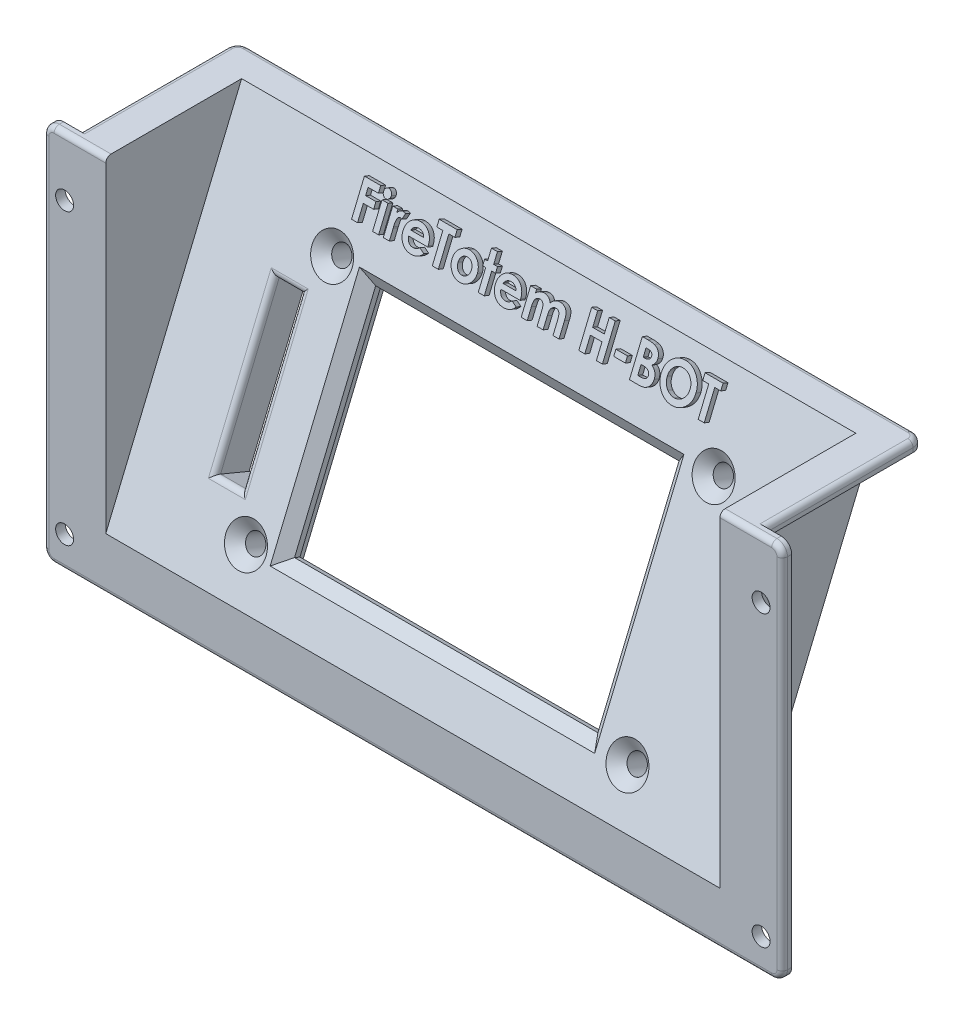
from build123d import *

# Parameters (mm, degrees)
SKETCH_1_R          = 1.7
EXTRUDE_1_DEPTH     = 1.8
EXTRUDE_2_DEPTH     = 1.8
EXTRUDE_3_DEPTH     = 116.4
EXTRUDE_4_DEPTH     = 1.8
EXTRUDE_5_DEPTH     = 1.8
SKETCH_6_W          = 91.3
SKETCH_6_H          = 51.75
EXTRUDE_6_DEPTH     = 5.2
SKETCH_7_W          = 5
SKETCH_7_H          = 29
CUT_EXTRUDE_1_DEPTH = 6.861538462
SKETCH_8_W          = 63
SKETCH_8_H          = 45
CUT_EXTRUDE_2_DEPTH = 3.75
SKETCH_9_W          = 57.5
SKETCH_9_H          = 40
CUT_EXTRUDE_3_DEPTH = 3.111538462
SKETCH_10_R         = 1.8
CUT_EXTRUDE_4_DEPTH = 6.861538462
FILLET_1_R          = 1
CHAMFER_1_SIZE      = 2
FILLET_2_R          = 1
SKETCH_12_W         = 1.13974359
SKETCH_12_H         = 4.640384615
SKETCH_12_W_2       = 2.198076923
SKETCH_12_H_2       = 1.058333333
EXTRUDE_7_DEPTH     = 1


with BuildPart() as part:
    # Эскиз1 → Бобышка-Вытянуть1 (new body)
    with BuildSketch(Plane.XY):
        with BuildLine():
            Line((-58.2, 35.9), (-58.2, -25.9))
            Line((-58.2, -25.9), (58.2, -25.9))
            Line((58.2, -25.9), (58.2, 35.9))
            Line((58.2, 35.9), (68, 35.9))
            ThreePointArc((68, 35.9), (69.414213562, 35.314213562), (70, 33.9))
            Line((70, 33.9), (70, -33.9))
            ThreePointArc((70, -33.9), (69.414213562, -35.314213562), (68, -35.9))
            Line((68, -35.9), (-68, -35.9))
            ThreePointArc((-68, -35.9), (-69.414213562, -35.314213562), (-70, -33.9))
            Line((-70, -33.9), (-70, 33.9))
            ThreePointArc((-70, 33.9), (-69.414213562, 35.314213562), (-68, 35.9))
            Line((-68, 35.9), (-58.2, 35.9))
        make_face()
        with Locations((-66, -29.9)):
            Circle(SKETCH_1_R, mode=Mode.SUBTRACT)
        with Locations((66, -29.9)):
            Circle(SKETCH_1_R, mode=Mode.SUBTRACT)
        with Locations((-66, 24.9)):
            Circle(SKETCH_1_R, mode=Mode.SUBTRACT)
        with Locations((66, 24.9)):
            Circle(SKETCH_1_R, mode=Mode.SUBTRACT)
    extrude(amount=EXTRUDE_1_DEPTH)

    # Эскиз2 → Бобышка-Вытянуть2 (add)
    with BuildSketch(Plane(origin=(0, 35.9, 0), x_dir=(1, 0, 0), z_dir=(0, 1, 0))):
        with BuildLine():
            Line((-58.2, 0), (-58.2, 24))
            Line((-58.2, 24), (58.2, 24))
            Line((58.2, 24), (58.2, 0))
            Line((58.2, 0), (65, 0))
            Line((65, 0), (65, 28))
            ThreePointArc((65, 28), (64.414213562, 29.414213562), (63, 30))
            Line((63, 30), (-63, 30))
            ThreePointArc((-63, 30), (-64.414213562, 29.414213562), (-65, 28))
            Line((-65, 28), (-65, 0))
            Line((-65, 0), (-58.2, 0))
        make_face()
    extrude(amount=-EXTRUDE_2_DEPTH)

    # Эскиз3 → Бобышка-Вытянуть3 (add)
    with BuildSketch(Plane.ZY.offset(-58.2)):
        Polygon((-25, 34.1), (0, -25.9), (1.8, -25.9), (-23.95, 35.9), (-25, 35.9), align=None)
    extrude(amount=EXTRUDE_3_DEPTH)

    # Эскиз4 → Бобышка-Вытянуть4 (add)
    with BuildSketch(Plane.ZY.offset(58.2)):
        Polygon((-25, 34.1), (0, -25.9), (0, 34.1), align=None)
    extrude(amount=EXTRUDE_4_DEPTH)

    # Эскиз5 → Бобышка-Вытянуть5 (add)
    with BuildSketch(Plane(origin=(58.2, 0, 0), x_dir=(0, 0, -1), z_dir=(1, 0, 0))):
        Polygon((25, 34.1), (0, 34.1), (0, -25.9), align=None)
    extrude(amount=EXTRUDE_5_DEPTH)

    # Эскиз6 → Бобышка-Вытянуть6 (add)
    with BuildSketch(Plane(origin=(0, -3.831360947, -9.195266272), x_dir=(-1, 0, 0), z_dir=(0, -0.38461538461538486, -0.923076923076923))):
        with Locations((2.35, 5.747307692)):
            Rectangle(SKETCH_6_W, SKETCH_6_H)
    extrude(amount=EXTRUDE_6_DEPTH)

    # Эскиз7 → Вырез-Вытянуть1 (cut)
    with BuildSketch(Plane(origin=(0, -5.831360947, -13.995266272), x_dir=(-1, 0, 0), z_dir=(0, -0.3846153846153851, -0.9230769230769229))):
        with Locations((40.78, 5.272307692)):
            Rectangle(SKETCH_7_W, SKETCH_7_H)
    extrude(amount=-CUT_EXTRUDE_1_DEPTH, mode=Mode.SUBTRACT)

    # Эскиз8 → Вырез-Вытянуть2 (cut)
    with BuildSketch(Plane(origin=(0, -5.831360947, -13.995266272), x_dir=(-1, 0, 0), z_dir=(0, -0.3846153846153851, -0.9230769230769229))):
        with Locations((-1.19, 5.422307692)):
            Rectangle(SKETCH_8_W, SKETCH_8_H)
    extrude(amount=-CUT_EXTRUDE_2_DEPTH, mode=Mode.SUBTRACT)

    # Эскиз9 → Вырез-Вытянуть3 (cut)
    with BuildSketch(Plane(origin=(0, -4.389053254, -10.533727811), x_dir=(-1, 0, 0), z_dir=(0, -0.3846153846153849, -0.923076923076923))):
        with Locations((-0.69, 5.242307692)):
            Rectangle(SKETCH_9_W, SKETCH_9_H)
    extrude(amount=-CUT_EXTRUDE_3_DEPTH, mode=Mode.SUBTRACT)

    # Эскиз10 → Вырез-Вытянуть4 (cut)
    with BuildSketch(Plane(origin=(0, -5.831360947, -13.995266272), x_dir=(-1, 0, 0), z_dir=(0, -0.38461538461538497, -0.923076923076923))):
        with Locations(Location((-37.3, 26.622307692, 0), (0, 0, 90))):
            Circle(SKETCH_10_R)
        with Locations(Location((-37.3, -15.827692308, 0), (0, 0, 90))):
            Circle(SKETCH_10_R)
        with Locations(Location((35, 26.622307692, 0), (0, 0, 90))):
            Circle(SKETCH_10_R)
        with Locations(Location((35, -15.827692308, 0), (0, 0, 90))):
            Circle(SKETCH_10_R)
    extrude(amount=-CUT_EXTRUDE_4_DEPTH, mode=Mode.SUBTRACT)

    # Скругление1
    fillet_1_edges = [part.edges().sort_by_distance(p)[0] for p in [
        (-70, 0, 1.8),
        (-69.414213562, -35.314213562, 1.8),
        (0, -35.9, 1.8),
        (69.414213562, -35.314213562, 1.8),
        (70, 0, 1.8),
        (69.414213562, 35.314213562, 1.8),
        (63.1, 35.9, 1.8),
        (-63.1, 35.9, 1.8),
        (65, 35.9, -14),
        (64.414213562, 35.9, -29.414213562),
        (0, 35.9, -30),
        (-64.414213562, 35.9, -29.414213562),
        (-65, 35.9, -14),
        (-69.414213562, 35.314213562, 1.8),
    ]]
    fillet(fillet_1_edges, radius=FILLET_1_R)

    # Фаска1
    chamfer_1_edges = [part.edges().sort_by_distance(p)[0] for p in [
        (29.44, 1.646745562, -9.67781065),
        (0.69, 20.108284024, -17.370118343),
        (-28.06, 1.646745562, -9.67781065),
        (0.69, -16.814792899, -1.985502958),
        (37.3, -19.464023668, -0.881656804),
        (-35, 19.720591716, -17.208579881),
        (-35, -19.464023668, -0.881656804),
        (37.3, 19.720591716, -17.208579881),
    ]]
    chamfer(chamfer_1_edges, length=CHAMFER_1_SIZE)

    # Скругление2
    fillet_2_edges = [part.edges().sort_by_distance(p)[0] for p in [
        (-43.28, 1.67443787, -9.689349112),
        (-40.78, -11.710177515, -4.112426035),
        (-38.28, 1.67443787, -9.689349112),
        (-40.78, 15.059053255, -15.266272189),
    ]]
    fillet(fillet_2_edges, radius=FILLET_2_R)

    # Эскиз12 → Бобышка-Вытянуть7 (add)
    # profile 1 of 15: a face of its own
    with BuildSketch(Plane(origin=(0, -3.192307692, -7.661538462), x_dir=(1, 0, 0), z_dir=(0, 0.3846153846153848, 0.9230769230769229))):
        Polygon((-32.881004686, 39.425276213), (-29.787414943, 39.425276213), (-29.787414943, 38.285532623), (-31.741261096, 38.285532623), (-31.741261096, 37.064378777), (-29.787414943, 37.064378777), (-29.787414943, 35.924635187), (-31.741261096, 35.924635187), (-31.741261096, 33.075276213), (-32.881004686, 33.075276213), align=None)
    # profile 2 of 15: a face of its own
    with BuildSketch(Plane(origin=(0, -3.192307692, -7.661538462), x_dir=(1, 0, 0), z_dir=(0, 0.3846153846153848, 0.9230769230769229))):
        with BuildLine():
            add(Edge.make_bspline(
                [(-28.324574398, 39.669506982), (-28.275451457, 39.667096825), (-28.17899383, 39.662364249), (-28.040805154, 39.616232158), (-27.913975955, 39.54382922), (-27.801855426, 39.444490663), (-27.708604054, 39.325862257), (-27.637356542, 39.193049869), (-27.597667522, 39.045898021), (-27.592155304, 38.944247063), (-27.589338019, 38.892293441)],
                knots=[0, 0, 0, 0, 0.989868614, 1.943702388, 2.910836514, 3.924849579, 4.949916355, 5.946401046, 6.950409252, 8, 8, 8, 8], degree=3))
            add(Edge.make_bspline(
                [(-27.589338019, 38.892293441), (-27.592054506, 38.840722688), (-27.597347711, 38.74023462), (-27.63827001, 38.595080427), (-27.706657894, 38.462332546), (-27.800664543, 38.345465992), (-27.911569539, 38.247727341), (-28.035627423, 38.174009971), (-28.172491851, 38.130444198), (-28.267452747, 38.125316005), (-28.315670151, 38.12271211)],
                knots=[0, 0, 0, 0, 1.05296456, 2.051751585, 3.055639087, 4.085634717, 5.099016424, 6.062201612, 7.016062274, 8, 8, 8, 8], degree=3))
            add(Edge.make_bspline(
                [(-28.315670151, 38.12271211), (-28.365221894, 38.125113652), (-28.462518698, 38.129829174), (-28.601840807, 38.176069203), (-28.730361583, 38.247901921), (-28.841995734, 38.349270118), (-28.936315042, 38.468741469), (-29.004450434, 38.604645844), (-29.047070807, 38.752803913), (-29.052129808, 38.855960391), (-29.054722635, 38.908829899)],
                knots=[0, 0, 0, 0, 0.989065327, 1.942068821, 2.907541208, 3.917690034, 4.939857478, 5.938239964, 6.943311734, 8, 8, 8, 8], degree=3))
            add(Edge.make_bspline(
                [(-29.054722635, 38.908829899), (-29.05190093, 38.95952495), (-29.046358099, 39.059108058), (-29.006431337, 39.20298829), (-28.936817529, 39.333567893), (-28.844237856, 39.450024696), (-28.733102122, 39.547510215), (-28.606349061, 39.617714228), (-28.469090399, 39.661940932), (-28.373243797, 39.666958925), (-28.324574398, 39.669506982)],
                knots=[0, 0, 0, 0, 1.038616768, 2.040212704, 3.031499824, 4.052181184, 5.074969369, 6.039807101, 7.004644834, 8, 8, 8, 8], degree=3))
        make_face()
    # profile 3 of 15: a face of its own
    with BuildSketch(Plane(origin=(0, -3.192307692, -7.661538462), x_dir=(1, 0, 0), z_dir=(0, 0.3846153846153848, 0.9230769230769229))):
        with Locations((-28.322030327, 35.395468521)):
            Rectangle(SKETCH_12_W, SKETCH_12_H)
    # profile 4 of 15: a face of its own
    with BuildSketch(Plane(origin=(0, -3.192307692, -7.661538462), x_dir=(1, 0, 0), z_dir=(0, 0.3846153846153848, 0.9230769230769229))):
        with BuildLine():
            Line((-26.856645712, 37.715660828), (-25.879722635, 37.715660828))
            Line((-25.879722635, 37.715660828), (-25.879722635, 37.144516998))
            add(Edge.make_bspline(
                [(-25.879722635, 37.144516998), (-25.852087356, 37.195274708), (-25.798073058, 37.294482756), (-25.698844262, 37.427649915), (-25.584846203, 37.539799581), (-25.460175182, 37.633277466), (-25.324453347, 37.706134298), (-25.181315086, 37.758053977), (-25.031984946, 37.791794573), (-24.930116986, 37.795299583), (-24.878630888, 37.797071085)],
                knots=[0, 0, 0, 0, 1.09866127, 2.147379032, 3.14564304, 4.131443017, 5.102343063, 6.064490016, 7.021754664, 8, 8, 8, 8], degree=3))
            add(Edge.make_bspline(
                [(-24.878630888, 37.797071085), (-24.841245557, 37.795320471), (-24.765115672, 37.791755596), (-24.649083015, 37.771032922), (-24.531376211, 37.733562388), (-24.453914991, 37.699825152), (-24.414338019, 37.682587912)],
                knots=[0, 0, 0, 0, 0.931404136, 1.896671404, 2.925354185, 4, 4, 4, 4], degree=3))
            Line((-24.414338019, 37.682587912), (-24.767963821, 36.717113152))
            add(Edge.make_bspline(
                [(-24.767963821, 36.717113152), (-24.799572918, 36.732385139), (-24.858985852, 36.761090597), (-24.945243116, 36.794965993), (-25.02352516, 36.815635105), (-25.073154538, 36.818719117), (-25.096148917, 36.820148008)],
                knots=[0, 0, 0, 0, 1.214386998, 2.282580073, 3.20428172, 4, 4, 4, 4], degree=3))
            add(Edge.make_bspline(
                [(-25.096148917, 36.820148008), (-25.117860082, 36.819201149), (-25.160569684, 36.817338516), (-25.223607863, 36.801376379), (-25.282976699, 36.773850167), (-25.341537176, 36.738586359), (-25.39466952, 36.689567028), (-25.447769045, 36.632818448), (-25.49456319, 36.562754779), (-25.543944584, 36.484770357), (-25.585991075, 36.389317494), (-25.622044646, 36.275366447), (-25.654168668, 36.141598723), (-25.67627438, 35.987304081), (-25.697640439, 35.813975588), (-25.710358042, 35.620341034), (-25.719836632, 35.407012711), (-25.720416185, 35.258101843), (-25.720718228, 35.180494562)],
                knots=[0, 0, 0, 0, 0.544232178, 1.070598461, 1.618251235, 2.182094276, 2.777567932, 3.425210017, 4.127676488, 4.886675562, 5.738955394, 6.734782583, 7.883056018, 9.186093582, 10.642914445, 12.264202625, 14.053029461, 16, 16, 16, 16], degree=3))
            Line((-25.720718228, 35.180494562), (-25.716902122, 34.954072287))
            Line((-25.716902122, 34.954072287), (-25.716902122, 33.075276213))
            Line((-25.716902122, 33.075276213), (-26.856645712, 33.075276213))
            Line((-26.856645712, 33.075276213), (-26.856645712, 37.715660828))
        make_face()
    # profile 5 of 15: a face of its own
    with BuildSketch(Plane(origin=(0, -3.192307692, -7.661538462), x_dir=(1, 0, 0), z_dir=(0, 0.3846153846153848, 0.9230769230769229))):
        with BuildLine():
            Line((-19.207897715, 35.110532623), (-22.867543148, 35.110532623))
            add(Edge.make_bspline(
                [(-22.867543148, 35.110532623), (-22.860081426, 35.06800962), (-22.845418555, 34.984448562), (-22.813577608, 34.863068876), (-22.772943784, 34.748682708), (-22.724246706, 34.641137153), (-22.668307405, 34.539863659), (-22.603058844, 34.445337238), (-22.529328643, 34.357641383), (-22.44754309, 34.277157229), (-22.359065401, 34.205041683), (-22.264324661, 34.141863905), (-22.163223102, 34.090061993), (-22.056919817, 34.046398356), (-21.944620475, 34.011812332), (-21.8261598, 33.987959009), (-21.701851813, 33.973868763), (-21.617169414, 33.971830771), (-21.573883292, 33.970789033)],
                knots=[0, 0, 0, 0, 1.091296461, 2.144483647, 3.168565212, 4.157007626, 5.126487748, 6.090021542, 7.05641414, 8.019231907, 8.98705074, 9.938580405, 10.892824166, 11.854447369, 12.841318655, 13.858982407, 14.905600794, 16, 16, 16, 16], degree=3))
            add(Edge.make_bspline(
                [(-21.573883292, 33.970789033), (-21.521634004, 33.972168465), (-21.418739768, 33.974884972), (-21.267998947, 33.998976357), (-21.122210615, 34.035365334), (-20.982754443, 34.089478797), (-20.848015051, 34.156840547), (-20.720210662, 34.240764998), (-20.597129084, 34.338799604), (-20.522034816, 34.414364641), (-20.483749077, 34.452890396)],
                knots=[0, 0, 0, 0, 1.021034703, 2.010718019, 2.977989445, 3.954245119, 4.929443971, 5.918328161, 6.938689359, 8, 8, 8, 8], degree=3))
            Line((-20.483749077, 34.452890396), (-19.529722635, 33.998773809))
            add(Edge.make_bspline(
                [(-19.529722635, 33.998773809), (-19.559759601, 33.957267332), (-19.619276744, 33.875023775), (-19.716436482, 33.75928585), (-19.817828856, 33.651297669), (-19.923529484, 33.55176949), (-20.03367242, 33.460984927), (-20.147951274, 33.37783806), (-20.268036183, 33.30456135), (-20.391526073, 33.237609713), (-20.520973708, 33.180212385), (-20.656020848, 33.13126597), (-20.796095494, 33.087018827), (-20.942966485, 33.053304928), (-21.095410829, 33.026617281), (-21.253793201, 33.007665516), (-21.418092729, 32.995959919), (-21.52976616, 32.994572234), (-21.586603644, 32.993865957)],
                knots=[0, 0, 0, 0, 1.028154879, 2.037251081, 3.030720504, 4.000128189, 4.949298328, 5.894184978, 6.834267904, 7.770992897, 8.712077017, 9.673380525, 10.653304757, 11.658697181, 12.695551717, 13.758623199, 14.859225354, 16, 16, 16, 16], degree=3))
            add(Edge.make_bspline(
                [(-21.586603644, 32.993865957), (-21.674047181, 32.995648667), (-21.845300308, 32.999140003), (-22.095788963, 33.031544598), (-22.33368371, 33.08527491), (-22.559656281, 33.158313016), (-22.772729871, 33.254746197), (-22.973009931, 33.372691978), (-23.162497546, 33.5098891), (-23.33540281, 33.669216968), (-23.492924607, 33.842635879), (-23.631281959, 34.028875948), (-23.747057421, 34.226635984), (-23.842134559, 34.434607172), (-23.916031814, 34.653321836), (-23.969307448, 34.882875417), (-24.00196605, 35.123158279), (-24.005493341, 35.28681773), (-24.007286737, 35.370027816)],
                knots=[0, 0, 0, 0, 1.103565453, 2.161269334, 3.182010356, 4.179077853, 5.15417608, 6.128274628, 7.109042802, 8.101804412, 9.090965879, 10.063106201, 11.02526161, 11.978650795, 12.945248442, 13.93468508, 14.949922959, 16, 16, 16, 16], degree=3))
            add(Edge.make_bspline(
                [(-24.007286737, 35.370027816), (-24.005475691, 35.455352376), (-24.001912537, 35.623224618), (-23.969588638, 35.869055721), (-23.915884525, 36.103611842), (-23.841771105, 36.327215992), (-23.748136299, 36.540567507), (-23.630887792, 36.741799819), (-23.492993266, 36.931613507), (-23.336038938, 37.109120605), (-23.162401194, 37.269340154), (-22.977894686, 37.412127791), (-22.780446294, 37.531107927), (-22.57228933, 37.627243804), (-22.354755241, 37.705351777), (-22.125329636, 37.75732611), (-21.885758096, 37.792223763), (-21.721992266, 37.795437619), (-21.63875709, 37.797071085)],
                knots=[0, 0, 0, 0, 1.079208495, 2.12329425, 3.130605359, 4.119693003, 5.099659317, 6.073216462, 7.060498243, 8.06384408, 9.066070512, 10.045757761, 11.010926815, 11.975797609, 12.942977511, 13.929384301, 14.947594487, 16, 16, 16, 16], degree=3))
            add(Edge.make_bspline(
                [(-21.63875709, 37.797071085), (-21.550894639, 37.795260717), (-21.378385773, 37.791706246), (-21.126152541, 37.759564768), (-20.886678201, 37.705506816), (-20.658942459, 37.633100257), (-20.445853593, 37.534231072), (-20.242729395, 37.41918775), (-20.054441935, 37.279025008), (-19.878984269, 37.12047684), (-19.720597866, 36.944573142), (-19.582150601, 36.753487851), (-19.464349018, 36.549085846), (-19.368869666, 36.330538235), (-19.295048291, 36.098501118), (-19.24172334, 35.853275841), (-19.209313845, 35.593929686), (-19.205852189, 35.416340509), (-19.204081609, 35.325506582)],
                knots=[0, 0, 0, 0, 1.080001299, 2.120471247, 3.119684163, 4.095710327, 5.052285597, 6.002875087, 6.961153713, 7.931888285, 8.906493152, 9.865905668, 10.82813294, 11.801621613, 12.7925306, 13.817193356, 14.883530496, 16, 16, 16, 16], degree=3))
            Line((-19.204081609, 35.325506582), (-19.207897715, 35.110532623))
        make_face()
        with BuildLine():
            add(Edge.make_bspline(
                [(-20.343825199, 36.006045444), (-20.365332858, 36.064085902), (-20.408095686, 36.179485453), (-20.504695135, 36.338708675), (-20.632879513, 36.476602452), (-20.78196714, 36.598680906), (-20.95230909, 36.697767405), (-21.138537589, 36.769509248), (-21.338298744, 36.812526558), (-21.475723655, 36.817571732), (-21.545898516, 36.820148008)],
                knots=[0, 0, 0, 0, 0.954238005, 1.897273737, 2.851915805, 3.847685534, 4.862635127, 5.880135777, 6.917509367, 8, 8, 8, 8], degree=3))
            add(Edge.make_bspline(
                [(-21.545898516, 36.820148008), (-21.622540891, 36.817673182), (-21.772360774, 36.812835411), (-21.988465755, 36.76138395), (-22.192312176, 36.684594182), (-22.312488473, 36.605422299), (-22.372721433, 36.565740957)],
                knots=[0, 0, 0, 0, 1.044195649, 2.041185066, 3.018232172, 4, 4, 4, 4], degree=3))
            add(Edge.make_bspline(
                [(-22.372721433, 36.565740957), (-22.410302301, 36.535518777), (-22.490422792, 36.471086634), (-22.594475504, 36.342550627), (-22.696968291, 36.186922377), (-22.755241091, 36.068711727), (-22.786132891, 36.006045444)],
                knots=[0, 0, 0, 0, 0.82159062, 1.751589201, 2.808063854, 4, 4, 4, 4], degree=3))
            Line((-22.786132891, 36.006045444), (-20.343825199, 36.006045444))
        make_face(mode=Mode.SUBTRACT)
    # profile 6 of 15: a face of its own
    with BuildSketch(Plane(origin=(0, -3.192307692, -7.661538462), x_dir=(1, 0, 0), z_dir=(0, 0.3846153846153848, 0.9230769230769229))):
        Polygon((-18.715620071, 39.425276213), (-15.296389301, 39.425276213), (-15.296389301, 38.285532623), (-16.436132891, 38.285532623), (-16.436132891, 33.075276213), (-17.575876481, 33.075276213), (-17.575876481, 38.285532623), (-18.715620071, 38.285532623), align=None)
    # profile 7 of 15: a face of its own
    with BuildSketch(Plane(origin=(0, -3.192307692, -7.661538462), x_dir=(1, 0, 0), z_dir=(0, 0.3846153846153848, 0.9230769230769229))):
        with BuildLine():
            add(Edge.make_bspline(
                [(-12.352899718, 37.797071085), (-12.299014842, 37.796112167), (-12.192298369, 37.794213074), (-12.033357516, 37.778404862), (-11.877195314, 37.752613112), (-11.722914166, 37.719217298), (-11.571946716, 37.672424768), (-11.423501157, 37.616304364), (-11.276250199, 37.551871576), (-11.133848579, 37.475174022), (-10.995267553, 37.39198853), (-10.863884494, 37.300228107), (-10.740790445, 37.200613499), (-10.623700364, 37.09545435), (-10.518070837, 36.980172375), (-10.41715157, 36.86032234), (-10.326394985, 36.731610439), (-10.242367461, 36.597173083), (-10.167558361, 36.457787696), (-10.102600416, 36.314423894), (-10.046223027, 36.169063781), (-10.002080661, 36.019936772), (-9.96553485, 35.869009305), (-9.942471847, 35.714431877), (-9.92607565, 35.557792387), (-9.924237117, 35.452329792), (-9.923312378, 35.399284626)],
                knots=[0, 0, 0, 0, 1.022364134, 2.024744242, 3.027414945, 4.024939316, 5.017584196, 6.023349371, 7.035562955, 8.064994934, 9.090267829, 10.101425541, 11.102933353, 12.093946398, 13.084502048, 14.067315274, 15.065326281, 16.070028806, 17.074376865, 18.064572984, 19.055292013, 20.030201733, 21.013838017, 21.999348303, 22.993720005, 24, 24, 24, 24], degree=3))
            add(Edge.make_bspline(
                [(-9.923312378, 35.399284626), (-9.924288286, 35.345825046), (-9.926228613, 35.239535281), (-9.941878652, 35.081422402), (-9.967769125, 34.926118069), (-10.001293113, 34.772707356), (-10.047910532, 34.623153301), (-10.102378011, 34.475251417), (-10.169238984, 34.331017664), (-10.243158715, 34.188878586), (-10.327726501, 34.053016902), (-10.418404525, 33.923015619), (-10.518901093, 33.802285279), (-10.623685026, 33.687081701), (-10.737726465, 33.581300553), (-10.859205095, 33.48322423), (-10.987069248, 33.391653708), (-11.122238403, 33.308737402), (-11.262981268, 33.2358818), (-11.406924241, 33.17019653), (-11.554909021, 33.115508853), (-11.706629345, 33.070912558), (-11.862177227, 33.036382763), (-12.021209256, 33.012926262), (-12.183382938, 32.996612537), (-12.292649179, 32.994787377), (-12.347811577, 32.993865957)],
                knots=[0, 0, 0, 0, 1.012026251, 2.012137606, 3.004615893, 3.992048833, 4.982446996, 5.968083444, 6.973977695, 7.990229942, 8.999482246, 10.001782172, 10.988562221, 11.971415814, 12.948383116, 13.930088534, 14.925840678, 15.924049238, 16.929462851, 17.924729459, 18.917889337, 19.913673841, 20.916777188, 21.931792057, 22.95587778, 24, 24, 24, 24], degree=3))
            add(Edge.make_bspline(
                [(-12.347811577, 32.993865957), (-12.428470252, 32.996233448), (-12.587449727, 33.000899809), (-12.821588907, 33.032863161), (-13.046519369, 33.087880472), (-13.262607634, 33.164573389), (-13.470134405, 33.262852504), (-13.667288555, 33.384487834), (-13.856031231, 33.527084727), (-14.033093267, 33.689437942), (-14.195306078, 33.86755412), (-14.337018485, 34.057692055), (-14.457343787, 34.257001899), (-14.556173727, 34.465710932), (-14.632450287, 34.68410535), (-14.687534978, 34.911532231), (-14.719537409, 35.148630838), (-14.724164304, 35.309722471), (-14.726517507, 35.391652415)],
                knots=[0, 0, 0, 0, 1.029999031, 2.030143771, 3.011211297, 3.982305373, 4.953580601, 5.938004764, 6.935448627, 7.970290061, 9.001484052, 10.007591832, 10.993831261, 11.969999897, 12.951306496, 13.942897864, 14.953773953, 16, 16, 16, 16], degree=3))
            add(Edge.make_bspline(
                [(-14.726517507, 35.391652415), (-14.724082241, 35.479135635), (-14.719295775, 35.651082152), (-14.681289129, 35.902987719), (-14.620596616, 36.144175361), (-14.533476337, 36.373970399), (-14.422187842, 36.59279666), (-14.286329811, 36.800192615), (-14.125230825, 36.996205242), (-14.001861261, 37.114760398), (-13.939127683, 37.175045844)],
                knots=[0, 0, 0, 0, 1.043912699, 2.05178951, 3.033892, 4.007821512, 4.978932272, 5.95884105, 6.962068106, 8, 8, 8, 8], degree=3))
            add(Edge.make_bspline(
                [(-13.939127683, 37.175045844), (-13.881563354, 37.225015698), (-13.768000849, 37.323595875), (-13.583499155, 37.448628669), (-13.39459024, 37.556618857), (-13.199009949, 37.645406877), (-12.996213055, 37.712351611), (-12.787238776, 37.761081388), (-12.572130567, 37.791012645), (-12.426348036, 37.795041342), (-12.352899718, 37.797071085)],
                knots=[0, 0, 0, 0, 1.048115528, 2.067714963, 3.060638214, 4.039924844, 5.017819947, 5.994373833, 6.98952318, 8, 8, 8, 8], degree=3))
        make_face()
        with BuildLine():
            add(Edge.make_bspline(
                [(-12.327459013, 36.738737751), (-12.371586757, 36.737271091), (-12.458452696, 36.734383955), (-12.586321641, 36.718889467), (-12.707261436, 36.687132182), (-12.82367417, 36.646745608), (-12.933500491, 36.592734255), (-13.03974815, 36.529528525), (-13.136892504, 36.450434331), (-13.229634677, 36.363673787), (-13.313823898, 36.267328532), (-13.385561109, 36.162360448), (-13.449659896, 36.052785395), (-13.498262756, 35.934591693), (-13.538486269, 35.81100992), (-13.56570906, 35.680043369), (-13.584654221, 35.543155009), (-13.586060631, 35.449385544), (-13.586773917, 35.401828697)],
                knots=[0, 0, 0, 0, 1.030650113, 2.02884584, 2.99876339, 3.944280128, 4.900564847, 5.851248946, 6.823638398, 7.81794922, 8.81432732, 9.802856497, 10.78262424, 11.771747962, 12.779760563, 13.812642396, 14.89064281, 16, 16, 16, 16], degree=3))
            add(Edge.make_bspline(
                [(-13.586773917, 35.401828697), (-13.585939276, 35.352594756), (-13.58430813, 35.256376474), (-13.567417271, 35.115884844), (-13.539563689, 34.982559218), (-13.499992477, 34.856605555), (-13.450224997, 34.737119777), (-13.389166071, 34.624772278), (-13.316171289, 34.520238561), (-13.233412923, 34.423647351), (-13.142796047, 34.335970441), (-13.043505158, 34.260729398), (-12.939698185, 34.195354917), (-12.828982853, 34.142849119), (-12.712931636, 34.102310383), (-12.591200025, 34.072463075), (-12.463148322, 34.056382793), (-12.375837297, 34.053612966), (-12.331275119, 34.05219929)],
                knots=[0, 0, 0, 0, 1.141730614, 2.231293227, 3.276944405, 4.297399982, 5.28939179, 6.275415646, 7.257752684, 8.24146775, 9.222424823, 10.176631434, 11.126518621, 12.063689483, 13.012557477, 13.974037417, 14.965980454, 16, 16, 16, 16], degree=3))
            add(Edge.make_bspline(
                [(-12.331275119, 34.05219929), (-12.286690653, 34.053453157), (-12.199279217, 34.055911464), (-12.071077141, 34.0743203), (-11.948723879, 34.10329218), (-11.831681494, 34.144179819), (-11.720896283, 34.197809476), (-11.615944151, 34.263496717), (-11.51590182, 34.339784295), (-11.424068857, 34.429115502), (-11.339060839, 34.526007945), (-11.264513892, 34.631093488), (-11.202219651, 34.743441016), (-11.151127219, 34.862343636), (-11.111478435, 34.987637919), (-11.084085974, 35.119789566), (-11.065130683, 35.258389031), (-11.063756081, 35.353424981), (-11.063055968, 35.401828697)],
                knots=[0, 0, 0, 0, 1.031504075, 2.022346795, 2.991027682, 3.937587355, 4.885570121, 5.833146507, 6.798790848, 7.791235734, 8.792807298, 9.778388351, 10.766749885, 11.760164525, 12.768777521, 13.802286646, 14.880660483, 16, 16, 16, 16], degree=3))
            add(Edge.make_bspline(
                [(-11.063055968, 35.401828697), (-11.063901227, 35.450215496), (-11.065559899, 35.545166092), (-11.082451961, 35.683953011), (-11.110032197, 35.815677507), (-11.150113789, 35.939777129), (-11.199585459, 36.057667656), (-11.260686589, 36.16874565), (-11.334041358, 36.272464025), (-11.417202036, 36.368308486), (-11.509177315, 36.454755089), (-11.606744275, 36.531844474), (-11.71213397, 36.595603318), (-11.823369227, 36.648163366), (-11.940745991, 36.688600819), (-12.064132485, 36.71861728), (-12.193906852, 36.734468747), (-12.282476366, 36.737299878), (-12.327459013, 36.738737751)],
                knots=[0, 0, 0, 0, 1.123894411, 2.205445421, 3.243160173, 4.246488011, 5.231014757, 6.210004299, 7.185865357, 8.177612767, 9.153374344, 10.115157457, 11.061423229, 12.009021698, 12.96873347, 13.94135618, 14.954456845, 16, 16, 16, 16], degree=3))
        make_face(mode=Mode.SUBTRACT)
    # profile 8 of 15: a face of its own
    with BuildSketch(Plane(origin=(0, -3.192307692, -7.661538462), x_dir=(1, 0, 0), z_dir=(0, 0.3846153846153848, 0.9230769230769229))):
        Polygon((-8.864979045, 39.588096726), (-7.725235455, 39.588096726), (-7.725235455, 37.715660828), (-6.992543148, 37.715660828), (-6.992543148, 36.738737751), (-7.725235455, 36.738737751), (-7.725235455, 33.075276213), (-8.864979045, 33.075276213), (-8.864979045, 36.738737751), (-9.43485084, 36.738737751), (-9.43485084, 37.715660828), (-8.864979045, 37.715660828), align=None)
    # profile 9 of 15: a face of its own
    with BuildSketch(Plane(origin=(0, -3.192307692, -7.661538462), x_dir=(1, 0, 0), z_dir=(0, 0.3846153846153848, 0.9230769230769229))):
        with BuildLine():
            Line((-1.704692587, 35.110532623), (-5.364338019, 35.110532623))
            add(Edge.make_bspline(
                [(-5.364338019, 35.110532623), (-5.356876298, 35.06800962), (-5.342213426, 34.984448562), (-5.31037248, 34.863068876), (-5.269738656, 34.748682708), (-5.221041578, 34.641137153), (-5.165102277, 34.539863659), (-5.099853716, 34.445337238), (-5.026123515, 34.357641383), (-4.944337962, 34.277157229), (-4.855860273, 34.205041683), (-4.761119532, 34.141863905), (-4.660017974, 34.090061993), (-4.553714689, 34.046398356), (-4.441415347, 34.011812332), (-4.322954672, 33.987959009), (-4.198646684, 33.973868763), (-4.113964286, 33.971830771), (-4.070678164, 33.970789033)],
                knots=[0, 0, 0, 0, 1.091296461, 2.144483647, 3.168565212, 4.157007626, 5.126487748, 6.090021542, 7.05641414, 8.019231907, 8.98705074, 9.938580405, 10.892824166, 11.854447369, 12.841318655, 13.858982407, 14.905600794, 16, 16, 16, 16], degree=3))
            add(Edge.make_bspline(
                [(-4.070678164, 33.970789033), (-4.018428875, 33.972168465), (-3.91553464, 33.974884972), (-3.764793819, 33.998976357), (-3.619005487, 34.035365334), (-3.479549315, 34.089478797), (-3.344809923, 34.156840547), (-3.217005534, 34.240764998), (-3.093923955, 34.338799604), (-3.018829688, 34.414364641), (-2.980543949, 34.452890396)],
                knots=[0, 0, 0, 0, 1.021034703, 2.010718019, 2.977989445, 3.954245119, 4.929443971, 5.918328161, 6.938689359, 8, 8, 8, 8], degree=3))
            Line((-2.980543949, 34.452890396), (-2.026517507, 33.998773809))
            add(Edge.make_bspline(
                [(-2.026517507, 33.998773809), (-2.056554472, 33.957267332), (-2.116071615, 33.875023775), (-2.213231354, 33.75928585), (-2.314623728, 33.651297669), (-2.420324356, 33.55176949), (-2.530467292, 33.460984927), (-2.644746145, 33.37783806), (-2.764831055, 33.30456135), (-2.888320945, 33.237609713), (-3.01776858, 33.180212385), (-3.15281572, 33.13126597), (-3.292890366, 33.087018827), (-3.439761357, 33.053304928), (-3.592205701, 33.026617281), (-3.750588073, 33.007665516), (-3.9148876, 32.995959919), (-4.026561032, 32.994572234), (-4.083398516, 32.993865957)],
                knots=[0, 0, 0, 0, 1.028154879, 2.037251081, 3.030720504, 4.000128189, 4.949298328, 5.894184978, 6.834267904, 7.770992897, 8.712077017, 9.673380525, 10.653304757, 11.658697181, 12.695551717, 13.758623199, 14.859225354, 16, 16, 16, 16], degree=3))
            add(Edge.make_bspline(
                [(-4.083398516, 32.993865957), (-4.170842053, 32.995648667), (-4.34209518, 32.999140003), (-4.592583835, 33.031544598), (-4.830478582, 33.08527491), (-5.056451153, 33.158313016), (-5.269524743, 33.254746197), (-5.469804803, 33.372691978), (-5.659292417, 33.5098891), (-5.832197682, 33.669216968), (-5.989719479, 33.842635879), (-6.128076831, 34.028875948), (-6.243852293, 34.226635984), (-6.338929431, 34.434607172), (-6.412826686, 34.653321836), (-6.46610232, 34.882875417), (-6.498760922, 35.123158279), (-6.502288213, 35.28681773), (-6.504081609, 35.370027816)],
                knots=[0, 0, 0, 0, 1.103565453, 2.161269334, 3.182010356, 4.179077853, 5.15417608, 6.128274628, 7.109042802, 8.101804412, 9.090965879, 10.063106201, 11.02526161, 11.978650795, 12.945248442, 13.93468508, 14.949922959, 16, 16, 16, 16], degree=3))
            add(Edge.make_bspline(
                [(-6.504081609, 35.370027816), (-6.502270562, 35.455352376), (-6.498707409, 35.623224618), (-6.46638351, 35.869055721), (-6.412679397, 36.103611842), (-6.338565977, 36.327215992), (-6.24493117, 36.540567507), (-6.127682664, 36.741799819), (-5.989788138, 36.931613507), (-5.83283381, 37.109120605), (-5.659196066, 37.269340154), (-5.474689558, 37.412127791), (-5.277241166, 37.531107927), (-5.069084202, 37.627243804), (-4.851550113, 37.705351777), (-4.622124508, 37.75732611), (-4.382552967, 37.792223763), (-4.218787138, 37.795437619), (-4.135551962, 37.797071085)],
                knots=[0, 0, 0, 0, 1.079208495, 2.12329425, 3.130605359, 4.119693003, 5.099659317, 6.073216462, 7.060498243, 8.06384408, 9.066070512, 10.045757761, 11.010926815, 11.975797609, 12.942977511, 13.929384301, 14.947594487, 16, 16, 16, 16], degree=3))
            add(Edge.make_bspline(
                [(-4.135551962, 37.797071085), (-4.047689511, 37.795260717), (-3.875180645, 37.791706246), (-3.622947413, 37.759564768), (-3.383473073, 37.705506816), (-3.155737331, 37.633100257), (-2.942648465, 37.534231072), (-2.739524267, 37.41918775), (-2.551236807, 37.279025008), (-2.375779141, 37.12047684), (-2.217392738, 36.944573142), (-2.078945473, 36.753487851), (-1.96114389, 36.549085846), (-1.865664538, 36.330538235), (-1.791843162, 36.098501118), (-1.738518212, 35.853275841), (-1.706108717, 35.593929686), (-1.702647061, 35.416340509), (-1.700876481, 35.325506582)],
                knots=[0, 0, 0, 0, 1.080001299, 2.120471247, 3.119684163, 4.095710327, 5.052285597, 6.002875087, 6.961153713, 7.931888285, 8.906493152, 9.865905668, 10.82813294, 11.801621613, 12.7925306, 13.817193356, 14.883530496, 16, 16, 16, 16], degree=3))
            Line((-1.700876481, 35.325506582), (-1.704692587, 35.110532623))
        make_face()
        with BuildLine():
            add(Edge.make_bspline(
                [(-2.840620071, 36.006045444), (-2.862127729, 36.064085902), (-2.904890557, 36.179485453), (-3.001490006, 36.338708675), (-3.129674384, 36.476602452), (-3.278762012, 36.598680906), (-3.449103962, 36.697767405), (-3.635332461, 36.769509248), (-3.835093616, 36.812526558), (-3.972518526, 36.817571732), (-4.042693388, 36.820148008)],
                knots=[0, 0, 0, 0, 0.954238005, 1.897273737, 2.851915805, 3.847685534, 4.862635127, 5.880135777, 6.917509367, 8, 8, 8, 8], degree=3))
            add(Edge.make_bspline(
                [(-4.042693388, 36.820148008), (-4.119335762, 36.817673182), (-4.269155646, 36.812835411), (-4.485260627, 36.76138395), (-4.689107048, 36.684594182), (-4.809283345, 36.605422299), (-4.869516305, 36.565740957)],
                knots=[0, 0, 0, 0, 1.044195649, 2.041185066, 3.018232172, 4, 4, 4, 4], degree=3))
            add(Edge.make_bspline(
                [(-4.869516305, 36.565740957), (-4.907097173, 36.535518777), (-4.987217664, 36.471086634), (-5.091270376, 36.342550627), (-5.193763163, 36.186922377), (-5.252035963, 36.068711727), (-5.282927763, 36.006045444)],
                knots=[0, 0, 0, 0, 0.82159062, 1.751589201, 2.808063854, 4, 4, 4, 4], degree=3))
            Line((-5.282927763, 36.006045444), (-2.840620071, 36.006045444))
        make_face(mode=Mode.SUBTRACT)
    # profile 10 of 15: a face of its own
    with BuildSketch(Plane(origin=(0, -3.192307692, -7.661538462), x_dir=(1, 0, 0), z_dir=(0, 0.3846153846153848, 0.9230769230769229))):
        with BuildLine():
            Line((-0.723953404, 37.715660828), (0.415790186, 37.715660828))
            Line((0.415790186, 37.715660828), (0.415790186, 37.161053457))
            add(Edge.make_bspline(
                [(0.415790186, 37.161053457), (0.466485401, 37.212219498), (0.566300115, 37.312961227), (0.73171262, 37.442473777), (0.904254613, 37.553223008), (1.086017027, 37.642881481), (1.276555282, 37.7113422), (1.474966323, 37.761509205), (1.682269273, 37.791106167), (1.823414563, 37.795060739), (1.895167189, 37.797071085)],
                knots=[0, 0, 0, 0, 1.041528618, 2.050684245, 3.032913108, 4.004406485, 4.976926473, 5.95771665, 6.961784757, 8, 8, 8, 8], degree=3))
            add(Edge.make_bspline(
                [(1.895167189, 37.797071085), (1.967014553, 37.794811165), (2.108443765, 37.790362587), (2.314788002, 37.749653924), (2.510266198, 37.683516103), (2.692727634, 37.589244766), (2.863491034, 37.472824564), (3.014991467, 37.328240864), (3.151360064, 37.161249229), (3.224049775, 37.035001758), (3.261333054, 36.970248168)],
                knots=[0, 0, 0, 0, 1.023965777, 2.015643508, 2.987309376, 3.958410333, 4.93654923, 5.924956801, 6.93568961, 8, 8, 8, 8], degree=3))
            add(Edge.make_bspline(
                [(3.261333054, 36.970248168), (3.309358736, 37.035177912), (3.403619672, 37.162616779), (3.570705766, 37.329002668), (3.751375684, 37.472839641), (3.949124973, 37.590104261), (4.158702098, 37.683194324), (4.379189974, 37.749408186), (4.608589586, 37.790294551), (4.764708611, 37.794793475), (4.843744913, 37.797071085)],
                knots=[0, 0, 0, 0, 1.041189987, 2.043563759, 3.033412161, 4.015238574, 5.00275396, 5.986226558, 6.980513695, 8, 8, 8, 8], degree=3))
            add(Edge.make_bspline(
                [(4.843744913, 37.797071085), (4.925380028, 37.794706138), (5.084356826, 37.790100624), (5.314737035, 37.744790426), (5.530515979, 37.674779372), (5.726925004, 37.572896153), (5.904524287, 37.452211446), (6.055860301, 37.309617428), (6.181455364, 37.150089814), (6.263233856, 37.001129947), (6.316101455, 36.869432367), (6.34802338, 36.754830796), (6.377880257, 36.626863647), (6.399329435, 36.483810863), (6.419351296, 36.327017027), (6.430974774, 36.155439723), (6.438875373, 35.969656954), (6.439714516, 35.841114868), (6.44014916, 35.774535027)],
                knots=[0, 0, 0, 0, 1.321991808, 2.574456155, 3.791773975, 4.987670122, 6.148905103, 7.262530793, 8.344737981, 9.427709016, 10.004683293, 10.642050061, 11.354108788, 12.133887687, 12.985666279, 13.916212488, 14.92067847, 16, 16, 16, 16], degree=3))
            Line((6.44014916, 35.774535027), (6.44014916, 33.075276213))
            Line((6.44014916, 33.075276213), (5.30040557, 33.075276213))
            Line((5.30040557, 33.075276213), (5.30040557, 35.405644803))
            add(Edge.make_bspline(
                [(5.30040557, 35.405644803), (5.29945695, 35.467977831), (5.297636158, 35.587620445), (5.289895271, 35.759224934), (5.272567855, 35.914855397), (5.252257903, 36.05537388), (5.223193971, 36.18003534), (5.187755782, 36.289140287), (5.146647699, 36.382845776), (5.097010927, 36.461142038), (5.041417684, 36.527079859), (4.979578222, 36.583601629), (4.91213731, 36.631825884), (4.838483498, 36.672930208), (4.756687245, 36.700729876), (4.669509864, 36.722542488), (4.576269164, 36.737397032), (4.511802566, 36.738282617), (4.478670795, 36.738737751)],
                knots=[0, 0, 0, 0, 1.669139205, 3.203761885, 4.596586177, 5.860166715, 7.002923539, 8.018877315, 8.928339525, 9.734594377, 10.491888885, 11.231098709, 11.971440889, 12.708030942, 13.480072485, 14.275788656, 15.113863979, 16, 16, 16, 16], degree=3))
            add(Edge.make_bspline(
                [(4.478670795, 36.738737751), (4.427615205, 36.736972627), (4.32742877, 36.733508923), (4.181436715, 36.700409345), (4.044057115, 36.646295079), (3.915804651, 36.572677413), (3.799439032, 36.480730338), (3.697648571, 36.371672341), (3.613583847, 36.24487491), (3.555392195, 36.127232328), (3.519029723, 36.020859795), (3.493379303, 35.929760264), (3.473385821, 35.826740168), (3.457736778, 35.712842864), (3.442723349, 35.587424479), (3.435357844, 35.450643608), (3.427820686, 35.302690274), (3.427918804, 35.200435486), (3.427969673, 35.147421646)],
                knots=[0, 0, 0, 0, 1.129913425, 2.217230253, 3.297175357, 4.391411011, 5.481605898, 6.571841268, 7.681894157, 8.841607612, 9.468549532, 10.170608623, 10.93710061, 11.791434153, 12.717934886, 13.734733707, 14.825576123, 16, 16, 16, 16], degree=3))
            Line((3.427969673, 35.147421646), (3.427969673, 33.075276213))
            Line((3.427969673, 33.075276213), (2.288226083, 33.075276213))
            Line((2.288226083, 33.075276213), (2.288226083, 35.300065876))
            add(Edge.make_bspline(
                [(2.288226083, 35.300065876), (2.28813039, 35.349681615), (2.287946307, 35.445126225), (2.282413148, 35.582950068), (2.275086165, 35.710211487), (2.264814587, 35.827265436), (2.252968345, 35.933966328), (2.235871487, 36.029730436), (2.217909661, 36.115085449), (2.187113867, 36.212046196), (2.143718634, 36.319494931), (2.07888552, 36.433438332), (2.000493431, 36.528839077), (1.910523722, 36.606439587), (1.80885409, 36.665564949), (1.698060144, 36.70954687), (1.576026342, 36.733286961), (1.492026432, 36.736882479), (1.448682814, 36.738737751)],
                knots=[0, 0, 0, 0, 1.256487322, 2.417074606, 3.49288742, 4.484586665, 5.393016842, 6.210437544, 6.947749329, 7.599905853, 8.784490193, 9.876739139, 10.906602197, 11.896672079, 12.869113195, 13.872201355, 14.902064413, 16, 16, 16, 16], degree=3))
            add(Edge.make_bspline(
                [(1.448682814, 36.738737751), (1.399708255, 36.73707547), (1.302713733, 36.733783308), (1.161426394, 36.698422794), (1.026342594, 36.645301423), (0.900434041, 36.569630449), (0.785821477, 36.47551958), (0.685050156, 36.363359519), (0.601427224, 36.233283308), (0.54297727, 36.112395723), (0.507145006, 36.003369343), (0.480804883, 35.909904325), (0.461555286, 35.804615496), (0.44549447, 35.68868506), (0.430569925, 35.561976174), (0.423173945, 35.423931624), (0.415644234, 35.274704419), (0.415740362, 35.171602445), (0.415790186, 35.118164835)],
                knots=[0, 0, 0, 0, 1.07893236, 2.136834559, 3.195274846, 4.273923004, 5.364443877, 6.458052972, 7.587287137, 8.767908, 9.410170275, 10.118584836, 10.909717261, 11.770069756, 12.702352573, 13.724628867, 14.820678298, 16, 16, 16, 16], degree=3))
            Line((0.415790186, 35.118164835), (0.415790186, 33.075276213))
            Line((0.415790186, 33.075276213), (-0.723953404, 33.075276213))
            Line((-0.723953404, 33.075276213), (-0.723953404, 37.715660828))
        make_face()
    # profile 11 of 15: a face of its own
    with BuildSketch(Plane(origin=(0, -3.192307692, -7.661538462), x_dir=(1, 0, 0), z_dir=(0, 0.3846153846153848, 0.9230769230769229))):
        Polygon((10.185020955, 39.425276213), (11.324764545, 39.425276213), (11.324764545, 36.982968521), (13.522841468, 36.982968521), (13.522841468, 39.425276213), (14.662585057, 39.425276213), (14.662585057, 33.075276213), (13.522841468, 33.075276213), (13.522841468, 35.843224931), (11.324764545, 35.843224931), (11.324764545, 33.075276213), (10.185020955, 33.075276213), align=None)
    # profile 12 of 15: a face of its own
    with BuildSketch(Plane(origin=(0, -3.192307692, -7.661538462), x_dir=(1, 0, 0), z_dir=(0, 0.3846153846153848, 0.9230769230769229))):
        with Locations((17.227008135, 35.395468521)):
            Rectangle(SKETCH_12_W_2, SKETCH_12_H_2)
    # profile 13 of 15: a face of its own
    with BuildSketch(Plane(origin=(0, -3.192307692, -7.661538462), x_dir=(1, 0, 0), z_dir=(0, 0.3846153846153848, 0.9230769230769229))):
        with BuildLine():
            Line((19.791431211, 33.075276213), (19.791431211, 39.425276213))
            Line((19.791431211, 39.425276213), (20.809059416, 39.425276213))
            add(Edge.make_bspline(
                [(20.809059416, 39.425276213), (20.880299754, 39.425284343), (21.018148456, 39.425300075), (21.217028158, 39.418316073), (21.401472285, 39.409281484), (21.570893866, 39.399173879), (21.725581267, 39.381756457), (21.865299261, 39.363400397), (21.990327005, 39.34126412), (22.067624865, 39.321407194), (22.103991307, 39.312065075)],
                knots=[0, 0, 0, 0, 1.311965854, 2.538629056, 3.664479157, 4.713267157, 5.663616078, 6.530575999, 7.308677837, 8, 8, 8, 8], degree=3))
            add(Edge.make_bspline(
                [(22.103991307, 39.312065075), (22.151744139, 39.29888785), (22.245450525, 39.273029905), (22.379667973, 39.220808667), (22.506991945, 39.162761059), (22.627266982, 39.096539595), (22.739754546, 39.021344796), (22.844027148, 38.936579893), (22.942333688, 38.845647347), (23.031183527, 38.746012893), (23.111489142, 38.640730636), (23.181260323, 38.529828162), (23.241882537, 38.415001244), (23.290396187, 38.294804861), (23.326950311, 38.169792549), (23.353685845, 38.04049813), (23.371014091, 37.906512486), (23.372651383, 37.815357673), (23.373482493, 37.769086309)],
                knots=[0, 0, 0, 0, 1.099996261, 2.158545794, 3.195537121, 4.207578794, 5.205712374, 6.197378256, 7.190519799, 8.17788031, 9.159561366, 10.129234751, 11.085776129, 12.040971148, 13.00380137, 13.975669004, 14.972423361, 16, 16, 16, 16], degree=3))
            add(Edge.make_bspline(
                [(23.373482493, 37.769086309), (23.371309386, 37.709639752), (23.367031891, 37.592626508), (23.339706963, 37.420755223), (23.288468465, 37.258312155), (23.221424136, 37.102303539), (23.13026481, 36.953311289), (23.014510096, 36.811406247), (22.876034841, 36.672218943), (22.769816677, 36.588785544), (22.714568231, 36.545388392)],
                knots=[0, 0, 0, 0, 0.986156485, 1.941127874, 2.875419072, 3.804401753, 4.751181392, 5.761612777, 6.835722519, 8, 8, 8, 8], degree=3))
            add(Edge.make_bspline(
                [(22.714568231, 36.545388392), (22.759338921, 36.522533343), (22.847121859, 36.477720915), (22.971747841, 36.40406266), (23.087137897, 36.325717764), (23.1938094, 36.244262557), (23.289524794, 36.156244037), (23.378236327, 36.066733949), (23.455567433, 35.97060374), (23.52471924, 35.871279673), (23.584824866, 35.767323522), (23.637170238, 35.658910848), (23.681384496, 35.545671289), (23.718826274, 35.428181143), (23.746750361, 35.306036297), (23.76495746, 35.179193069), (23.778897953, 35.048084058), (23.779982393, 34.958775874), (23.780533775, 34.913367158)],
                knots=[0, 0, 0, 0, 1.164658916, 2.283573913, 3.35186032, 4.395461096, 5.390182219, 6.362969632, 7.312859996, 8.245001507, 9.165155236, 10.092416118, 11.032087915, 11.979892451, 12.947605196, 13.931445124, 14.948243989, 16, 16, 16, 16], degree=3))
            add(Edge.make_bspline(
                [(23.780533775, 34.913367158), (23.77695567, 34.826639108), (23.769894292, 34.65548165), (23.718264944, 34.404183191), (23.62875606, 34.165929459), (23.508564087, 33.941667377), (23.36046445, 33.737888964), (23.190192338, 33.559380843), (22.999462, 33.408277681), (22.823490211, 33.306294769), (22.671288471, 33.237854699), (22.545222614, 33.195540731), (22.409830555, 33.156341135), (22.262632237, 33.12881437), (22.106296166, 33.103618848), (21.939298055, 33.08806261), (21.761950019, 33.077520531), (21.640139722, 33.076039444), (21.577368711, 33.075276213)],
                knots=[0, 0, 0, 0, 1.284142165, 2.534249414, 3.780121997, 5.041676246, 6.291546858, 7.49970053, 8.684500223, 9.883330709, 10.50184324, 11.153274765, 11.851151195, 12.587658647, 13.369265475, 14.195992086, 15.070362669, 16, 16, 16, 16], degree=3))
            Line((21.577368711, 33.075276213), (19.791431211, 33.075276213))
        make_face()
        with BuildLine():
            Line((20.931174801, 38.285532623), (20.931174801, 36.901558264))
            Line((20.931174801, 36.901558264), (21.233919192, 36.901558264))
            add(Edge.make_bspline(
                [(21.233919192, 36.901558264), (21.275064875, 36.90191707), (21.354494125, 36.902609723), (21.469221252, 36.911530855), (21.575898953, 36.92675086), (21.674122621, 36.947986595), (21.764807246, 36.974952883), (21.847373509, 37.007399134), (21.92145838, 37.046987088), (22.007527866, 37.105955091), (22.098509519, 37.192729149), (22.178599645, 37.318092254), (22.225772194, 37.462259348), (22.231025944, 37.563937145), (22.233738904, 37.616442078)],
                knots=[0, 0, 0, 0, 1.065314748, 2.056525647, 2.977365736, 3.853934255, 4.656397591, 5.425096493, 6.14721249, 6.826394842, 8.123232004, 9.372140726, 10.643011755, 12, 12, 12, 12], degree=3))
            add(Edge.make_bspline(
                [(22.233738904, 37.616442078), (22.231568039, 37.665621672), (22.22737076, 37.76070844), (22.179874068, 37.894218731), (22.106102315, 38.012536173), (22.019004392, 38.093514786), (21.936984773, 38.148820791), (21.866754542, 38.185237441), (21.789671589, 38.217837253), (21.704243673, 38.242763864), (21.610958632, 38.261467915), (21.510269604, 38.275203801), (21.402002866, 38.284553029), (21.3272228, 38.285199088), (21.288616708, 38.285532623)],
                knots=[0, 0, 0, 0, 1.347982417, 2.606269829, 3.849316587, 5.153353503, 5.842674298, 6.568177932, 7.326619318, 8.142485038, 9.012069166, 9.942760135, 10.937925643, 12, 12, 12, 12], degree=3))
            Line((21.288616708, 38.285532623), (20.931174801, 38.285532623))
        make_face(mode=Mode.SUBTRACT)
        with BuildLine():
            Line((20.931174801, 35.843224931), (20.931174801, 34.215019803))
            Line((20.931174801, 34.215019803), (21.259359897, 34.215019803))
            add(Edge.make_bspline(
                [(21.259359897, 34.215019803), (21.324242509, 34.215390475), (21.448987425, 34.216103138), (21.627684297, 34.224713802), (21.790164428, 34.240233008), (21.935997307, 34.259607487), (22.065406305, 34.285856875), (22.177953987, 34.319229607), (22.2751838, 34.355945426), (22.356512749, 34.401293821), (22.422953841, 34.454068108), (22.482909961, 34.508004697), (22.531794445, 34.570225647), (22.570472761, 34.638059987), (22.603948775, 34.709822662), (22.624139143, 34.788315979), (22.63951138, 34.871213584), (22.640357356, 34.928552065), (22.640790186, 34.957888392)],
                knots=[0, 0, 0, 0, 1.753078804, 3.370512758, 4.83203934, 6.162291463, 7.344201807, 8.395507345, 9.331626367, 10.147333109, 10.898971645, 11.62040215, 12.321813352, 13.025280112, 13.727906689, 14.453419512, 15.208716525, 16, 16, 16, 16], degree=3))
            add(Edge.make_bspline(
                [(22.640790186, 34.957888392), (22.639835671, 34.991434945), (22.637976535, 35.056774604), (22.622792941, 35.152275489), (22.595199391, 35.241431902), (22.560443968, 35.326523693), (22.512079951, 35.404504278), (22.454600969, 35.47807227), (22.385151686, 35.544736431), (22.307051916, 35.608528857), (22.215956266, 35.664382582), (22.111821997, 35.712845581), (21.994083395, 35.753320094), (21.862375752, 35.785545928), (21.717276465, 35.812895547), (21.557726468, 35.829226289), (21.385054548, 35.84137218), (21.265321029, 35.842593314), (21.203390346, 35.843224931)],
                knots=[0, 0, 0, 0, 0.845221588, 1.646264278, 2.427170338, 3.19324141, 3.95557735, 4.731569926, 5.540061037, 6.376114724, 7.268642756, 8.224665384, 9.265483498, 10.400594375, 11.639216012, 12.983232105, 14.439614077, 16, 16, 16, 16], degree=3))
            Line((21.203390346, 35.843224931), (20.931174801, 35.843224931))
        make_face(mode=Mode.SUBTRACT)
    # profile 14 of 15: a face of its own
    with BuildSketch(Plane(origin=(0, -3.192307692, -7.661538462), x_dir=(1, 0, 0), z_dir=(0, 0.3846153846153848, 0.9230769230769229))):
        with BuildLine():
            add(Edge.make_bspline(
                [(27.904472077, 39.588096726), (28.014874609, 39.585238207), (28.232834214, 39.579594842), (28.553374138, 39.532552995), (28.862273623, 39.455905048), (29.159392985, 39.349358859), (29.443988272, 39.210028615), (29.717063345, 39.041864419), (29.977640063, 38.841692274), (30.223048245, 38.614181865), (30.449849666, 38.366774229), (30.646373229, 38.100395923), (30.813961314, 37.821949077), (30.952858768, 37.530687585), (31.058655032, 37.224594321), (31.132896646, 36.905229956), (31.180593205, 36.572685348), (31.186079043, 36.346267796), (31.188867109, 36.231195684)],
                knots=[0, 0, 0, 0, 1.014329547, 2.002516266, 2.970391464, 3.935626869, 4.897733899, 5.877609409, 6.878433252, 7.912639331, 8.949961323, 9.958554974, 10.949718813, 11.932905612, 12.9188844, 13.919928257, 14.942845884, 16, 16, 16, 16], degree=3))
            add(Edge.make_bspline(
                [(31.188867109, 36.231195684), (31.18589794, 36.11742017), (31.180047096, 35.893221868), (31.134843828, 35.563741789), (31.059351976, 35.247798482), (30.9553501, 34.944676803), (30.818971721, 34.655844969), (30.654651786, 34.379458829), (30.458054204, 34.118083312), (30.236349661, 33.871858682), (29.992272199, 33.648356997), (29.73375542, 33.451396523), (29.461992995, 33.28449965), (29.177382697, 33.147742825), (28.879314193, 33.041610889), (28.568523749, 32.966727097), (28.245030596, 32.921218704), (28.025039565, 32.915406078), (27.913376324, 32.9124557)],
                knots=[0, 0, 0, 0, 1.051557043, 2.072126891, 3.067553643, 4.050577992, 5.02905126, 6.015227836, 7.017913613, 8.04756643, 9.074058332, 10.072836633, 11.047628519, 12.017157415, 12.98668631, 13.966869689, 14.968021931, 16, 16, 16, 16], degree=3))
            add(Edge.make_bspline(
                [(27.913376324, 32.9124557), (27.796589962, 32.915102334), (27.567120726, 32.920302609), (27.231291471, 32.969754848), (26.909538027, 33.044247194), (26.604563308, 33.155423024), (26.313261407, 33.294402161), (26.037772604, 33.465563299), (25.778189482, 33.668623584), (25.536001053, 33.898382564), (25.316577749, 34.149789282), (25.122893643, 34.415378185), (24.959516804, 34.693120408), (24.826441253, 34.98314594), (24.721529834, 35.283652342), (24.647526748, 35.596469785), (24.603811359, 35.92084802), (24.597722059, 36.141172201), (24.59463634, 36.252820283)],
                knots=[0, 0, 0, 0, 1.067978421, 2.098431617, 3.099715153, 4.085208694, 5.062210972, 6.048429807, 7.046490867, 8.072918869, 9.098532598, 10.095778865, 11.076610158, 12.041847152, 13.011192615, 13.984257998, 14.978533688, 16, 16, 16, 16], degree=3))
            add(Edge.make_bspline(
                [(24.59463634, 36.252820283), (24.595604816, 36.327931268), (24.597529506, 36.477202161), (24.620714425, 36.698414004), (24.654094042, 36.91530809), (24.703460912, 37.127019657), (24.763429041, 37.335042232), (24.841126224, 37.537439491), (24.929566644, 37.736373592), (25.032900949, 37.929494874), (25.147798704, 38.115026461), (25.273162384, 38.292093167), (25.409307215, 38.458553997), (25.555794629, 38.615502863), (25.713129441, 38.761908129), (25.879242075, 38.899842365), (26.057354148, 39.025641548), (26.243567347, 39.142377944), (26.436831843, 39.247940642), (26.636360875, 39.337792454), (26.838043751, 39.416258511), (27.044574682, 39.478187392), (27.253740321, 39.528627818), (27.46777518, 39.561984937), (27.684745576, 39.585169214), (27.831056092, 39.587118573), (27.904472077, 39.588096726)],
                knots=[0, 0, 0, 0, 1.034744296, 2.056386356, 3.06226378, 4.057406941, 5.050368692, 6.043467995, 7.042652155, 8.049140477, 9.059438543, 10.048523776, 11.036952808, 12.020949711, 13.004946614, 13.997082645, 14.994316842, 16.007702937, 17.024872941, 18.026463647, 19.021641123, 20.005082605, 20.995858141, 21.984425357, 22.988620895, 24, 24, 24, 24], degree=3))
        make_face()
        with BuildLine():
            add(Edge.make_bspline(
                [(27.886663583, 38.448353136), (27.812362693, 38.446359476), (27.66572247, 38.44242479), (27.450627967, 38.412447801), (27.244129649, 38.364571142), (27.047372216, 38.295222387), (26.859502905, 38.206959023), (26.680188683, 38.100089452), (26.511912679, 37.970940153), (26.352431097, 37.826444575), (26.208365731, 37.665443295), (26.081079435, 37.492903041), (25.974561307, 37.309111955), (25.885351707, 37.115777411), (25.81819665, 36.910725413), (25.770364117, 36.695562156), (25.740135741, 36.469916904), (25.736325417, 36.316094829), (25.734379929, 36.23755586)],
                knots=[0, 0, 0, 0, 1.033739768, 2.040188636, 3.016340934, 3.979330865, 4.937572243, 5.900995986, 6.878200029, 7.884839167, 8.891893314, 9.879764717, 10.863503415, 11.843163062, 12.837761627, 13.859916423, 14.907309254, 16, 16, 16, 16], degree=3))
            add(Edge.make_bspline(
                [(25.734379929, 36.23755586), (25.736959349, 36.150517016), (25.742014584, 35.979935302), (25.777583832, 35.731095293), (25.838439275, 35.496090603), (25.926313351, 35.276070603), (26.035300259, 35.068592136), (26.170644702, 34.876198146), (26.330154741, 34.697736668), (26.453039982, 34.593543423), (26.515409577, 34.540660828)],
                knots=[0, 0, 0, 0, 1.078454662, 2.113592447, 3.107694534, 4.079536787, 5.043276885, 6.005368276, 6.987637804, 8, 8, 8, 8], degree=3))
            add(Edge.make_bspline(
                [(26.515409577, 34.540660828), (26.566502182, 34.501593198), (26.667536268, 34.424338138), (26.828808665, 34.32531993), (26.994887478, 34.240451449), (27.167025981, 34.171878719), (27.344860624, 34.117940563), (27.528367021, 34.080168559), (27.717285161, 34.05646336), (27.84504046, 34.05363014), (27.909560218, 34.05219929)],
                knots=[0, 0, 0, 0, 1.023928204, 2.024787132, 3.009472467, 3.9914905, 4.972207045, 5.96565515, 6.972602802, 8, 8, 8, 8], degree=3))
            add(Edge.make_bspline(
                [(27.909560218, 34.05219929), (27.982583502, 34.054209854), (28.12625911, 34.058165701), (28.337349512, 34.087773657), (28.539580529, 34.137881008), (28.734207627, 34.206621411), (28.920669589, 34.295992998), (29.098055126, 34.406177328), (29.266675241, 34.535821478), (29.425953645, 34.682214599), (29.571541636, 34.843850114), (29.698562312, 35.017310679), (29.808467185, 35.198774439), (29.895821669, 35.39080974), (29.96562987, 35.591603857), (30.012886714, 35.802046064), (30.043370451, 36.021268839), (30.047181849, 36.170457684), (30.049123519, 36.246460107)],
                knots=[0, 0, 0, 0, 1.026359118, 2.019393844, 2.989460624, 3.950973911, 4.916101784, 5.890408035, 6.881132271, 7.902007068, 8.92769091, 9.933912415, 10.920395702, 11.90457117, 12.894218921, 13.903490204, 14.931958862, 16, 16, 16, 16], degree=3))
            add(Edge.make_bspline(
                [(30.049123519, 36.246460107), (30.047114667, 36.322025495), (30.043160549, 36.470764437), (30.013500481, 36.689423592), (29.963710898, 36.898936758), (29.894764075, 37.099646094), (29.806722632, 37.291748368), (29.697850457, 37.474568036), (29.568529568, 37.647928356), (29.421736277, 37.810647943), (29.261960803, 37.96017682), (29.090425866, 38.089940704), (28.911931208, 38.202701393), (28.722381289, 38.291033564), (28.525654142, 38.361407617), (28.320549329, 38.413232079), (28.106290001, 38.4422142), (27.960524951, 38.446288584), (27.886663583, 38.448353136)],
                knots=[0, 0, 0, 0, 1.055025985, 2.07665775, 3.074803781, 4.057872707, 5.035505728, 6.020516407, 7.023567878, 8.050795229, 9.077271434, 10.074415901, 11.050397877, 12.019801805, 12.988065821, 13.964604439, 14.968634123, 16, 16, 16, 16], degree=3))
        make_face(mode=Mode.SUBTRACT)
    # profile 15 of 15: a face of its own
    with BuildSketch(Plane(origin=(0, -3.192307692, -7.661538462), x_dir=(1, 0, 0), z_dir=(0, 0.3846153846153848, 0.9230769230769229))):
        Polygon((31.677328647, 39.425276213), (35.096559416, 39.425276213), (35.096559416, 38.285532623), (33.956815827, 38.285532623), (33.956815827, 33.075276213), (32.817072237, 33.075276213), (32.817072237, 38.285532623), (31.677328647, 38.285532623), align=None)
    extrude(amount=EXTRUDE_7_DEPTH)


solid = part.part
